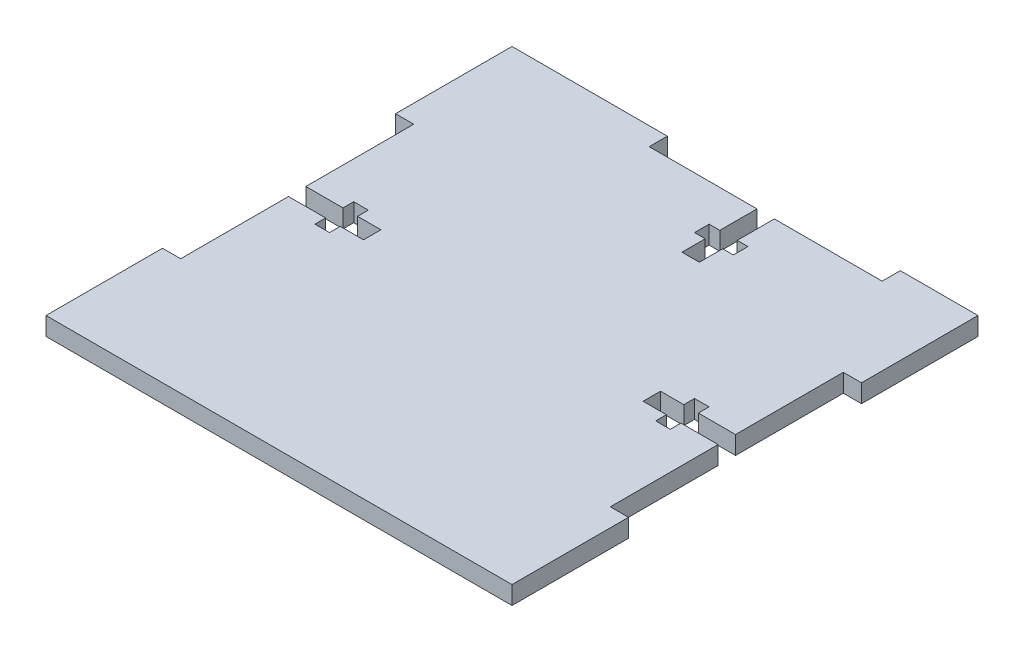
from build123d import *

# Parameters (mm, degrees)
SKETCH1_W           = 76.2
SKETCH1_H           = 76.2
BOSS_EXTRUDE1_DEPTH = 2.9718
SKETCH2_W           = 2.9718
SKETCH2_H           = 38.1
CUT_EXTRUDE1_DEPTH  = 54.963428313
CUT_EXTRUDE7_DEPTH  = 54.963428313
SKETCH8_W           = 1.7526
SKETCH8_H           = 2.38125
CUT_EXTRUDE8_DEPTH  = 54.963428313


with BuildPart() as part:
    # Sketch1 → Boss-Extrude1 (new body)
    with BuildSketch(Plane(origin=(0, 0, 0), x_dir=(1, 0, 0), z_dir=(0, 1, 0))):
        Rectangle(SKETCH1_W, SKETCH1_H)
    extrude(amount=BOSS_EXTRUDE1_DEPTH)

    # Sketch2 → Cut-Extrude1 (cut, through all)
    with BuildSketch(Plane(origin=(0, 2.9718, 0), x_dir=(1, 0, 0), z_dir=(0, 1, 0))):
        with Locations((36.6141, 0)):
            Rectangle(SKETCH2_W, SKETCH2_H)
    cut_extrude1 = extrude(amount=-CUT_EXTRUDE1_DEPTH, mode=Mode.SUBTRACT)

    # Sketch7 → Cut-Extrude7 (cut, through all)
    with BuildSketch(Plane(origin=(0, 2.9718, 0), x_dir=(1, 0, 0), z_dir=(0, 1, 0))):
        Polygon((35.1282, 1.4224), (29.05125, 1.4224), (29.05125, 3.175), (26.67, 3.175), (26.67, 1.4224), (22.86, 1.4224), (22.86, -1.4224), (26.67, -1.4224), (26.67, -3.175), (29.05125, -3.175), (29.05125, -1.4224), (35.1282, -1.4224), align=None)
    cut_extrude7 = extrude(amount=-CUT_EXTRUDE7_DEPTH, mode=Mode.SUBTRACT)

    # Sketch8 → Cut-Extrude8 (cut, through all)
    with BuildSketch(Plane(origin=(0, 2.9718, 0), x_dir=(1, 0, 0), z_dir=(0, 1, 0))):
        Polygon((25.4, 38.1), (-12.7, 38.1), (-12.7, 35.1282), (4.9276, 35.1282), (7.7724, 35.1282), (25.4, 35.1282), align=None)
        Polygon((7.7724, 35.1282), (4.9276, 35.1282), (4.9276, 29.05125), (4.9276, 26.67), (4.9276, 22.86), (7.7724, 22.86), (7.7724, 26.67), (7.7724, 29.05125), align=None)
        with Locations((8.6487, 27.860625)):
            Rectangle(SKETCH8_W, SKETCH8_H)
        with Locations((4.0513, 27.860625)):
            Rectangle(SKETCH8_W, SKETCH8_H)
    extrude(amount=-CUT_EXTRUDE8_DEPTH, mode=Mode.SUBTRACT)

    # Mirror1: Cut-Extrude1, Cut-Extrude7 across plane
    add(cut_extrude1.mirror(Plane(origin=(0, 0, 0), x_dir=(0, 0, 1), z_dir=(1, 0, 0))), mode=Mode.SUBTRACT)
    add(cut_extrude7.mirror(Plane(origin=(0, 0, 0), x_dir=(0, 0, 1), z_dir=(1, 0, 0))), mode=Mode.SUBTRACT)


solid = part.part
